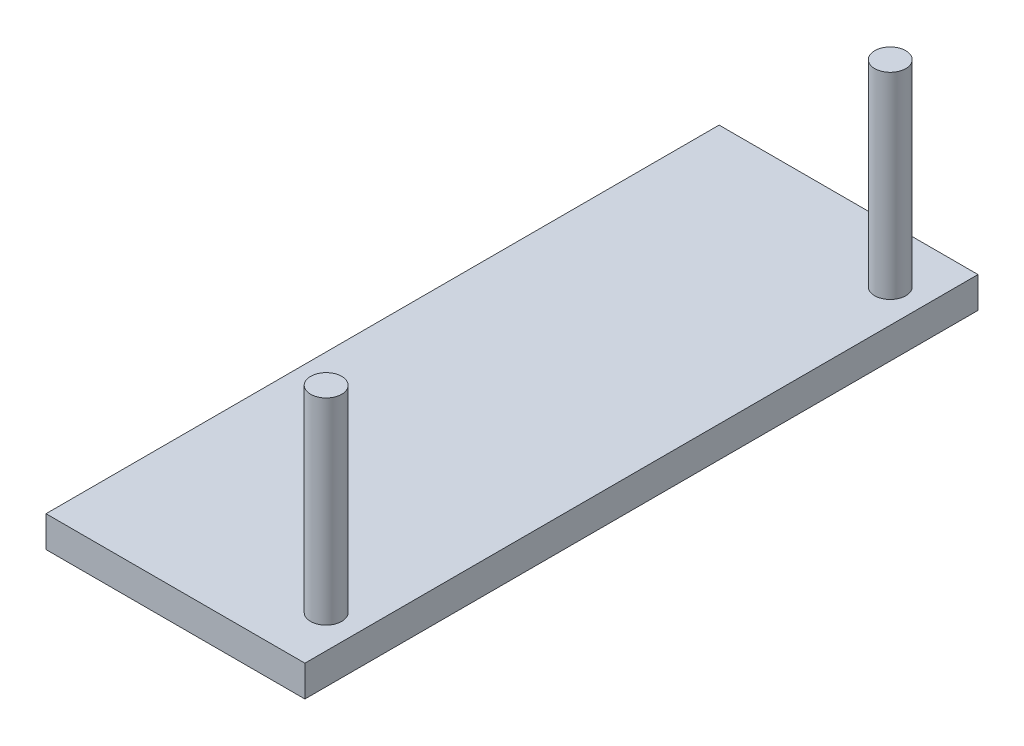
from build123d import *

# Parameters (mm, degrees)
SKETCH1_W           = 25
SKETCH1_H           = 65
BOSS_EXTRUDE1_DEPTH = 3
SKETCH2_R           = 1.5
BOSS_EXTRUDE2_DEPTH = 19


with BuildPart() as part:
    # Sketch1 → Boss-Extrude1 (new body)
    with BuildSketch(Plane(origin=(0, 0, 0), x_dir=(1, 0, 0), z_dir=(0, 1, 0))):
        Rectangle(SKETCH1_W, SKETCH1_H)
    extrude(amount=BOSS_EXTRUDE1_DEPTH)

    # Sketch2 → Boss-Extrude2 (add)
    with BuildSketch(Plane(origin=(0, 3, 0), x_dir=(1, 0, 0), z_dir=(0, 1, 0))):
        with Locations(Location((9.289666573, 27.234893969, 0), (0, 0, 90))):
            Circle(SKETCH2_R)
        with Locations(Location((9.289666573, -27.234893969, 0), (0, 0, 90))):
            Circle(SKETCH2_R)
    extrude(amount=BOSS_EXTRUDE2_DEPTH)


solid = part.part
